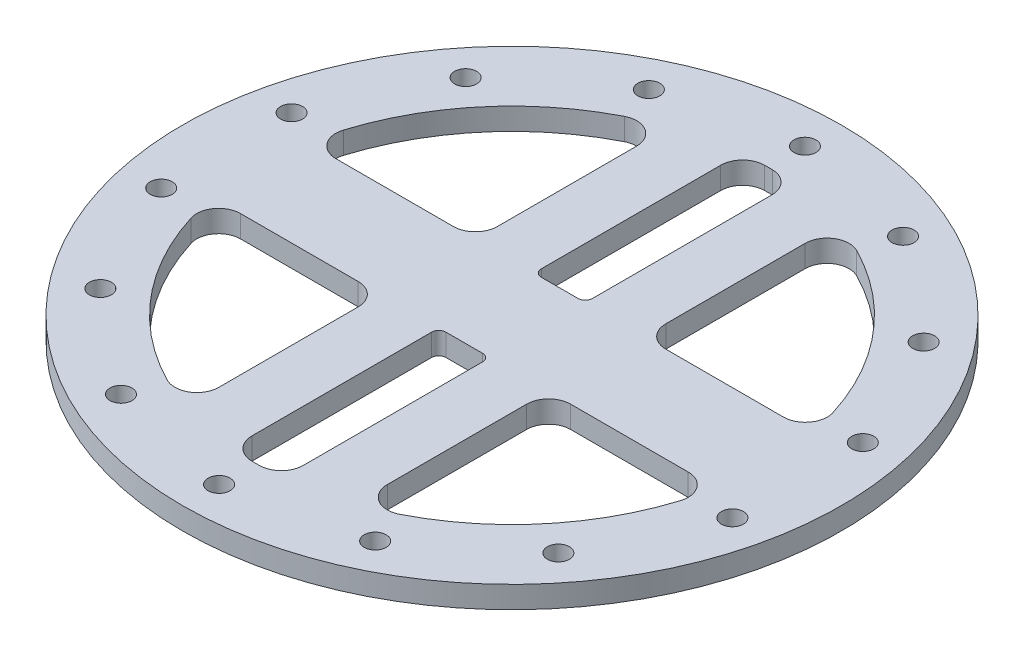
from build123d import *

# Parameters (mm, degrees)
SKETCH_1_R               = 45
SKETCH_1_R_2             = 35
EXTRUDE_1_DEPTH          = 3
EXTRUDE_2_DEPTH          = 3
SKETCH_3_R               = 1.5
CUT_EXTRUDE_1_DEPTH      = 3
PATTERN_CIRCULAR_1_COUNT = 14
FILLET_1_R               = 3
EXTRUDE_3_DEPTH          = 3
FILLET_2_R               = 3
FILLET_3_R               = 1
FILLET_4_R               = 3


with BuildPart() as part:
    # Эскиз1 → Бобышка-Вытянуть1 (new body)
    with BuildSketch(Plane(origin=(0, 0, 0), x_dir=(1, 0, 0), z_dir=(0, 1, 0))):
        with Locations(Location((0, 0, 0), (0, 0, 270))):
            Circle(SKETCH_1_R)
        with Locations(Location((0, 0, 0), (0, 0, 270))):
            Circle(SKETCH_1_R_2, mode=Mode.SUBTRACT)
    extrude(amount=EXTRUDE_1_DEPTH)

    # Эскиз2 → Бобышка-Вытянуть2 (add)
    with BuildSketch(Plane(origin=(0, 0, 0), x_dir=(1, 0, 0), z_dir=(0, 1, 0))):
        with BuildLine():
            ThreePointArc((-34.391132578, 6.5), (-34.847450698, 3.264227303), (-35, 0))
            Line((-35, 0), (35, 0))
            ThreePointArc((35, 0), (34.847450698, 3.264227303), (34.391132578, 6.5))
            Line((34.391132578, 6.5), (-34.391132578, 6.5))
        make_face()
        with BuildLine():
            Line((35, 0), (-35, 0))
            ThreePointArc((-35, 0), (-34.847450698, -3.264227303), (-34.391132578, -6.5))
            Line((-34.391132578, -6.5), (34.391132578, -6.5))
            ThreePointArc((34.391132578, -6.5), (34.847450698, -3.264227303), (35, 0))
        make_face()
    extrude(amount=EXTRUDE_2_DEPTH)

    # Эскиз3 → Вырез-Вытянуть1 (cut)
    with BuildSketch(Plane(origin=(0, 3, 0), x_dir=(1, 0, 0), z_dir=(0, 1, 0))):
        with Locations(Location((0, 40, 0), (0, 0, 270))):
            Circle(SKETCH_3_R)
    cut_extrude_1 = extrude(amount=-CUT_EXTRUDE_1_DEPTH, mode=Mode.SUBTRACT)

    # Круговой массив1: Вырез-Вытянуть1 ×14 about axis
    pattern_circular_1_axis = Axis((0, 0, 0), (0, 1, 0))
    for i in range(1, PATTERN_CIRCULAR_1_COUNT):
        add(cut_extrude_1.rotate(pattern_circular_1_axis, i * 360 / PATTERN_CIRCULAR_1_COUNT), mode=Mode.SUBTRACT)

    # Скругление1
    fillet_1_edges = [part.edges().sort_by_distance(p)[0] for p in [
        (-34.391132578, 1.5, -6.5),
        (-34.391132578, 1.5, 6.5),
        (34.391132578, 1.5, 6.5),
        (34.391132578, 1.5, -6.5),
    ]]
    fillet(fillet_1_edges, radius=FILLET_1_R)

    # Эскиз4 → Бобышка-Вытянуть3 (add)
    with BuildSketch(Plane(origin=(0, 0, 0), x_dir=(1, 0, 0), z_dir=(0, 1, 0))):
        with BuildLine():
            Line((-3.5, 6.5), (-3.5, 34.824560299))
            ThreePointArc((-3.5, 34.824560299), (-7.551905138, 34.175557476), (-11.5, 33.056769352))
            Line((-11.5, 33.056769352), (-11.5, 6.5))
            Line((-11.5, 6.5), (-3.5, 6.5))
        make_face()
        with BuildLine():
            Line((3.5, 6.5), (3.5, 34.824560299))
            ThreePointArc((3.5, 34.824560299), (7.551905138, 34.175557476), (11.5, 33.056769352))
            Line((11.5, 33.056769352), (11.5, 6.5))
            Line((11.5, 6.5), (3.5, 6.5))
        make_face()
    extrude_3 = extrude(amount=EXTRUDE_3_DEPTH)

    # Скругление2
    fillet_2_edges = [part.edges().sort_by_distance(p)[0] for p in [
        (-11.5, 1.5, -6.5),
        (-3.5, 1.5, -34.824560299),
        (-11.5, 1.5, -33.056769352),
        (11.5, 1.5, -6.5),
        (11.5, 1.5, -33.056769352),
        (3.5, 1.5, -34.824560299),
    ]]
    fillet(fillet_2_edges, radius=FILLET_2_R)

    # Зеркальное отражение1: Бобышка-Вытянуть3 across plane
    add(extrude_3.mirror(Plane.XY))

    # Скругление3
    fillet_3_edges = [part.edges().sort_by_distance(p)[0] for p in [
        (-3.5, 1.5, -6.5),
        (3.5, 1.5, -6.5),
        (-3.5, 1.5, 6.5),
        (3.5, 1.5, 6.5),
    ]]
    fillet(fillet_3_edges, radius=FILLET_3_R)

    # Скругление4
    fillet_4_edges = [part.edges().sort_by_distance(p)[0] for p in [
        (-11.5, 1.5, 6.5),
        (-11.5, 1.5, 33.056769352),
        (-3.5, 1.5, 34.824560299),
        (11.5, 1.5, 6.5),
        (3.5, 1.5, 34.824560299),
        (11.5, 1.5, 33.056769352),
    ]]
    fillet(fillet_4_edges, radius=FILLET_4_R)


solid = part.part
